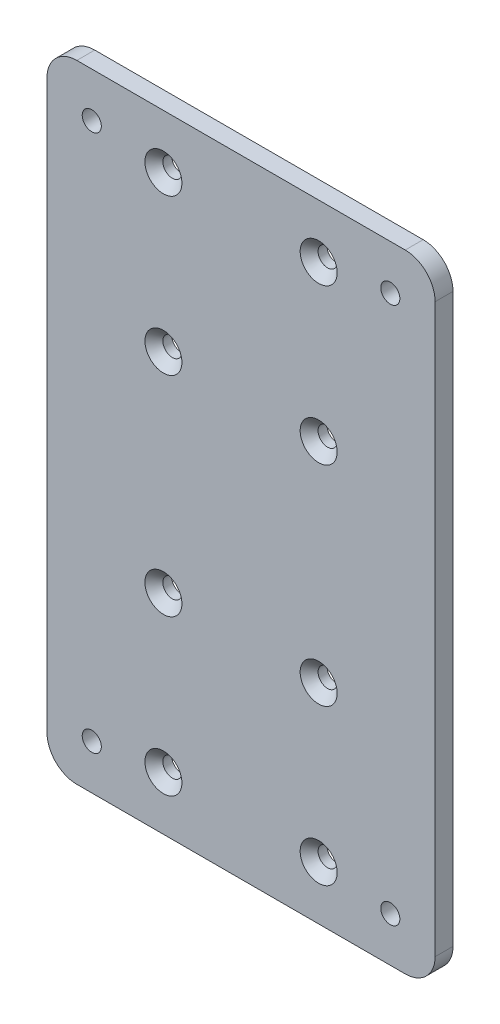
from build123d import *

# Parameters (mm, degrees)
SKETCH_2_W      = 65
SKETCH_2_H      = 105
SKETCH_2_R      = 1.6
EXTRUDE_1_DEPTH = 3
FILLET_1_R      = 5
CHAMFER_1_SIZE  = 1.5


with BuildPart() as part:
    # ｽｹｯﾁ2 → ﾎﾞｽ - 押し出し1 (new body)
    with BuildSketch(Plane.XY):
        Rectangle(SKETCH_2_W, SKETCH_2_H)
        with Locations((-13, 43.5)):
            Circle(SKETCH_2_R, mode=Mode.SUBTRACT)
        with Locations((13, 17.5)):
            Circle(SKETCH_2_R, mode=Mode.SUBTRACT)
        with Locations((13, 43.5)):
            Circle(SKETCH_2_R, mode=Mode.SUBTRACT)
        with Locations((-13, 17.5)):
            Circle(SKETCH_2_R, mode=Mode.SUBTRACT)
        with Locations((-13, -17.5)):
            Circle(SKETCH_2_R, mode=Mode.SUBTRACT)
        with Locations((13, -17.5)):
            Circle(SKETCH_2_R, mode=Mode.SUBTRACT)
        with Locations((-13, -43.5)):
            Circle(SKETCH_2_R, mode=Mode.SUBTRACT)
        with Locations((13, -43.5)):
            Circle(SKETCH_2_R, mode=Mode.SUBTRACT)
        with Locations((-25, 45)):
            Circle(SKETCH_2_R, mode=Mode.SUBTRACT)
        with Locations((25, 45)):
            Circle(SKETCH_2_R, mode=Mode.SUBTRACT)
        with Locations((25, -45)):
            Circle(SKETCH_2_R, mode=Mode.SUBTRACT)
        with Locations((-25, -45)):
            Circle(SKETCH_2_R, mode=Mode.SUBTRACT)
    extrude(amount=EXTRUDE_1_DEPTH)

    # ﾌｨﾚｯﾄ1
    fillet_1_edges = [part.edges().sort_by_distance(p)[0] for p in [
        (32.5, -52.5, 1.5),
        (-32.5, -52.5, 1.5),
        (-32.5, 52.5, 1.5),
        (32.5, 52.5, 1.5),
    ]]
    fillet(fillet_1_edges, radius=FILLET_1_R)

    # 面取り1
    chamfer_1_edges = [part.edges().sort_by_distance(p)[0] for p in [
        (11.4, 17.5, 3),
        (-14.6, 43.5, 3),
        (11.4, 43.5, 3),
        (-14.6, 17.5, 3),
        (-14.6, -17.5, 3),
        (11.4, -17.5, 3),
        (-14.6, -43.5, 3),
        (11.4, -43.5, 3),
    ]]
    chamfer(chamfer_1_edges, length=CHAMFER_1_SIZE)


solid = part.part
